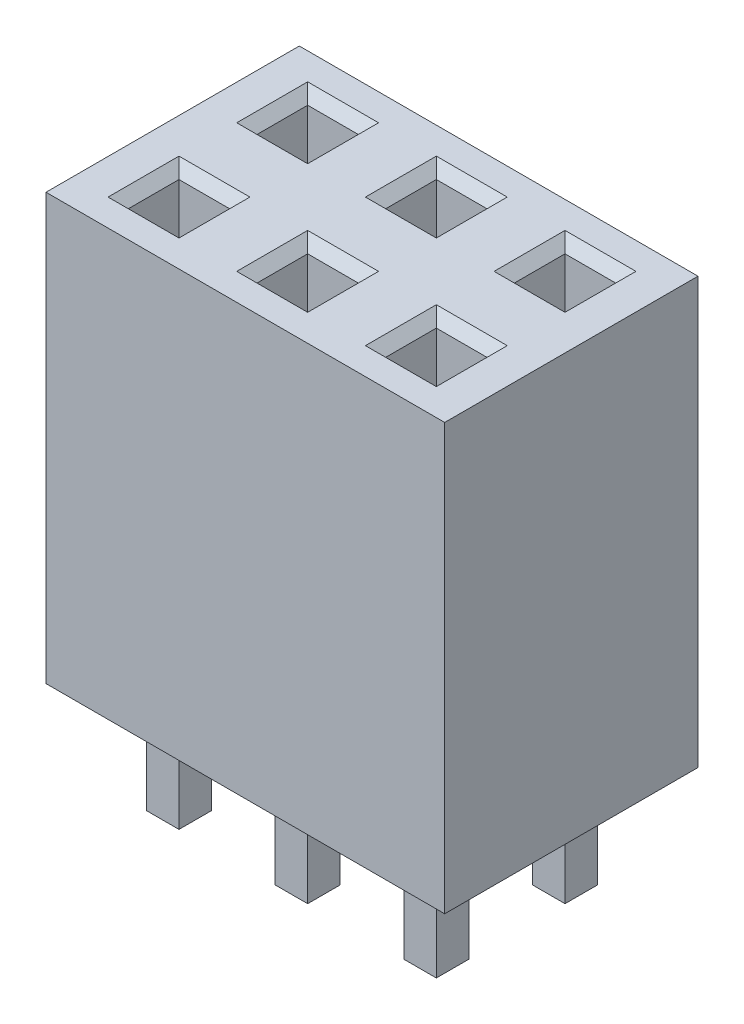
from build123d import *

# Parameters (mm, degrees)
SKETCH_1_W                         = 2.79
SKETCH_1_H                         = 5
EXTRUDE_1_DEPTH                    = 8.4
SKETCH_2_W                         = 1
SKETCH_2_H                         = 1
CUT_EXTRUDE_1_DEPTH                = 8
CHAMFER_1_SIZE                     = 0.2
SKETCH_3_W                         = 0.64
SKETCH_3_H                         = 0.64
EXTRUDE_2_DEPTH                    = 2.29
CHAMFER_2_SIZE                     = 0.2
PATTERN_LINEAR_1_COUNT             = 3
PATTERN_LINEAR_1_PITCH             = 2.54
CHAMFER_1_OF_PATTERN_LINEAR_1_SIZE = 0.2
CHAMFER_2_OF_PATTERN_LINEAR_1_SIZE = 0.2


with BuildPart() as part:
    # Эскиз1 → Бобышка-Вытянуть1 (new body)
    with BuildSketch(Plane(origin=(0, 0, 0), x_dir=(1, 0, 0), z_dir=(0, 1, 0))):
        Rectangle(SKETCH_1_W, SKETCH_1_H)
    extrude_1 = extrude(amount=EXTRUDE_1_DEPTH)

    # Эскиз2 → Вырез-Вытянуть1 (cut)
    with BuildSketch(Plane(origin=(0, 8.4, 0), x_dir=(1, 0, 0), z_dir=(0, 1, 0))):
        with Locations((0, 1.27)):
            Rectangle(SKETCH_2_W, SKETCH_2_H)
        with Locations((0, -1.27)):
            Rectangle(SKETCH_2_W, SKETCH_2_H)
    cut_extrude_1 = extrude(amount=-CUT_EXTRUDE_1_DEPTH, mode=Mode.SUBTRACT)

    # Фаска1
    chamfer_1_edges = [part.edges().sort_by_distance(p)[0] for p in [
        (0.5, 8.4, -1.27),
        (0, 8.4, -1.77),
        (-0.5, 8.4, -1.27),
        (0, 8.4, -0.77),
        (0, 8.4, 1.77),
        (0.5, 8.4, 1.27),
        (0, 8.4, 0.77),
        (-0.5, 8.4, 1.27),
    ]]
    chamfer(chamfer_1_edges, length=CHAMFER_1_SIZE)

    # Эскиз3 → Бобышка-Вытянуть2 (add)
    with BuildSketch(Plane(origin=(0, 0, 0), x_dir=(-1, 0, 0), z_dir=(0, -1, 0))):
        with Locations((0, 1.27)):
            Rectangle(SKETCH_3_W, SKETCH_3_H)
        with Locations((0, -1.27)):
            Rectangle(SKETCH_3_W, SKETCH_3_H)
    extrude_2 = extrude(amount=EXTRUDE_2_DEPTH)

    # Фаска2
    chamfer_2_edges = [part.edges().sort_by_distance(p)[0] for p in [
        (0.32, -2.29, -1.27),
        (0, -2.29, -0.95),
        (-0.32, -2.29, -1.27),
        (0, -2.29, -1.59),
        (-0.32, -2.29, 1.27),
        (0, -2.29, 0.95),
        (0.32, -2.29, 1.27),
        (0, -2.29, 1.59),
    ]]
    chamfer(chamfer_2_edges, length=CHAMFER_2_SIZE)

    # Линейный массив1: Бобышка-Вытянуть1, Вырез-Вытянуть1, Бобышка-Вытянуть2 ×3
    with Locations(*[(i * PATTERN_LINEAR_1_PITCH, 0, 0) for i in range(1, PATTERN_LINEAR_1_COUNT)]):
        add(extrude_1)
        add(cut_extrude_1, mode=Mode.SUBTRACT)
        add(extrude_2)

    # Фаска1 of Линейный массив1
    chamfer_1_of_pattern_linear_1_edges = [part.edges().sort_by_distance(p)[0] for p in [
        (3.04, 8.4, -1.27),
        (2.54, 8.4, -1.77),
        (2.04, 8.4, -1.27),
        (2.54, 8.4, -0.77),
        (2.54, 8.4, 1.77),
        (3.04, 8.4, 1.27),
        (2.54, 8.4, 0.77),
        (2.04, 8.4, 1.27),
        (5.58, 8.4, -1.27),
        (5.08, 8.4, -1.77),
        (4.58, 8.4, -1.27),
        (5.08, 8.4, -0.77),
        (5.08, 8.4, 1.77),
        (5.58, 8.4, 1.27),
        (5.08, 8.4, 0.77),
        (4.58, 8.4, 1.27),
    ]]
    chamfer(chamfer_1_of_pattern_linear_1_edges, length=CHAMFER_1_OF_PATTERN_LINEAR_1_SIZE)

    # Фаска2 of Линейный массив1
    chamfer_2_of_pattern_linear_1_edges = [part.edges().sort_by_distance(p)[0] for p in [
        (2.86, -2.29, -1.27),
        (2.54, -2.29, -0.95),
        (2.22, -2.29, -1.27),
        (2.54, -2.29, -1.59),
        (2.22, -2.29, 1.27),
        (2.54, -2.29, 0.95),
        (2.86, -2.29, 1.27),
        (2.54, -2.29, 1.59),
        (5.4, -2.29, -1.27),
        (5.08, -2.29, -0.95),
        (4.76, -2.29, -1.27),
        (5.08, -2.29, -1.59),
        (4.76, -2.29, 1.27),
        (5.08, -2.29, 0.95),
        (5.4, -2.29, 1.27),
        (5.08, -2.29, 1.59),
    ]]
    chamfer(chamfer_2_of_pattern_linear_1_edges, length=CHAMFER_2_OF_PATTERN_LINEAR_1_SIZE)


solid = part.part
